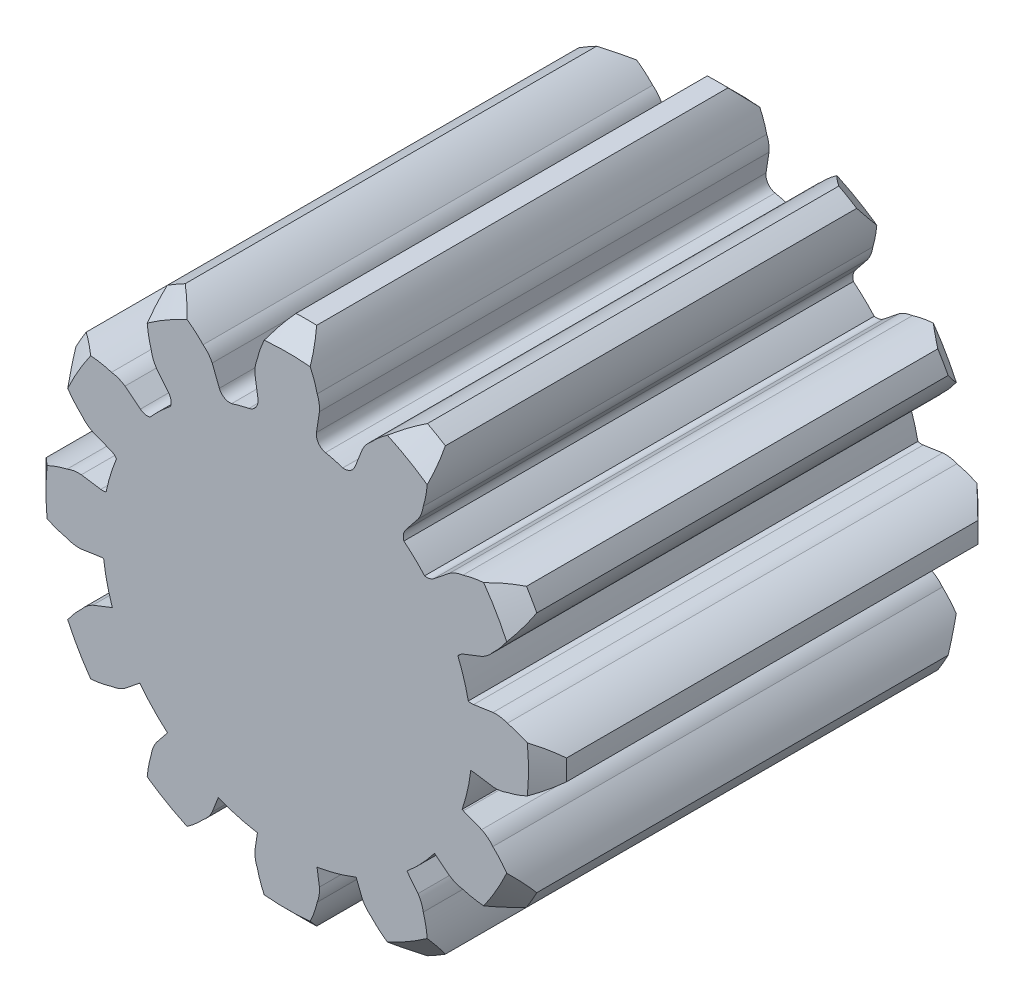
from build123d import *

# Parameters (mm, degrees)
SKETCH1_R                    = 4.833
BOSS_EXTRUDE1_DEPTH          = 11.754424205
BOSS_EXTRUDE2_DEPTH          = 11.754424
CHAMFER1_SIZE                = 0.5
CIRPATTERN2_COUNT            = 12
CHAMFER1_OF_CIRPATTERN2_SIZE = 0.5


with BuildPart() as part:
    # Sketch1 → Boss-Extrude1 (new body)
    with BuildSketch(Plane.XY):
        Circle(SKETCH1_R)
    extrude(amount=BOSS_EXTRUDE1_DEPTH)

    # Sketch2 → Boss-Extrude2 (add, through all)
    with BuildSketch(Plane.XY.offset(11.754424205)):
        with BuildLine():
            Line((0.765839864, 5.066673297), (0.842649147, 5.574831154))
            ThreePointArc((0.842649147, 5.574831154), (0.835145424, 5.765176716), (0.78371416, 5.94859581))
            ThreePointArc((0.78371416, 5.94859581), (0.587169015, 6.501190097), (0.270368272, 6.994776694))
            ThreePointArc((0.270368272, 6.994776694), (0, 7), (-0.270368272, 6.994776694))
            ThreePointArc((-0.270368272, 6.994776694), (-0.587169015, 6.501190097), (-0.78371416, 5.94859581))
            ThreePointArc((-0.78371416, 5.94859581), (-0.835145424, 5.765176716), (-0.842649147, 5.574831154))
            Line((-0.842649147, 5.574831154), (-0.765839864, 5.066673297))
            ThreePointArc((-0.765839864, 5.066673297), (-0.815914827, 4.850926567), (-1.000373974, 4.728333841))
            ThreePointArc((-1.000373974, 4.728333841), (0, 4.833), (1.000373974, 4.728333841))
            ThreePointArc((1.000373974, 4.728333841), (0.815914827, 4.850926567), (0.765839864, 5.066673297))
        make_face()
    boss_extrude2 = extrude(amount=-BOSS_EXTRUDE2_DEPTH)

    # Chamfer1
    chamfer1_edges = [part.edges().sort_by_distance(p)[0] for p in [
        (0, 7, 2.05e-07),
        (0, 7, 11.754424205),
    ]]
    chamfer(chamfer1_edges, length=CHAMFER1_SIZE)

    # CirPattern2: Boss-Extrude2 ×12 about axis
    cirpattern2_axis = Axis((0, 0.19286907, 0), (0, 0, 1))
    for i in range(1, CIRPATTERN2_COUNT):
        add(boss_extrude2.rotate(cirpattern2_axis, i * 360 / CIRPATTERN2_COUNT))

    # Chamfer1 of CirPattern2
    chamfer1_of_cirpattern2_edges = [part.edges().sort_by_distance(p)[0] for p in [
        (-3.403565465, 6.088017382, 2.05e-07),
        (-3.403565465, 6.088017382, 11.754424205),
        (-5.895148313, 3.596434535, 2.05e-07),
        (-5.895148313, 3.596434535, 11.754424205),
        (-6.80713093, 0.19286907, 2.05e-07),
        (-6.80713093, 0.19286907, 11.754424205),
        (-5.895148313, -3.210696396, 2.05e-07),
        (-5.895148313, -3.210696396, 11.754424205),
        (-3.403565465, -5.702279243, 2.05e-07),
        (-3.403565465, -5.702279243, 11.754424205),
        (0, -6.614261861, 2.05e-07),
        (0, -6.614261861, 11.754424205),
        (3.403565465, -5.702279243, 2.05e-07),
        (3.403565465, -5.702279243, 11.754424205),
        (5.895148313, -3.210696396, 2.05e-07),
        (5.895148313, -3.210696396, 11.754424205),
        (6.80713093, 0.19286907, 2.05e-07),
        (6.80713093, 0.19286907, 11.754424205),
        (5.895148313, 3.596434535, 2.05e-07),
        (5.895148313, 3.596434535, 11.754424205),
        (3.403565465, 6.088017382, 2.05e-07),
        (3.403565465, 6.088017382, 11.754424205),
    ]]
    chamfer(chamfer1_of_cirpattern2_edges, length=CHAMFER1_OF_CIRPATTERN2_SIZE)


solid = part.part
